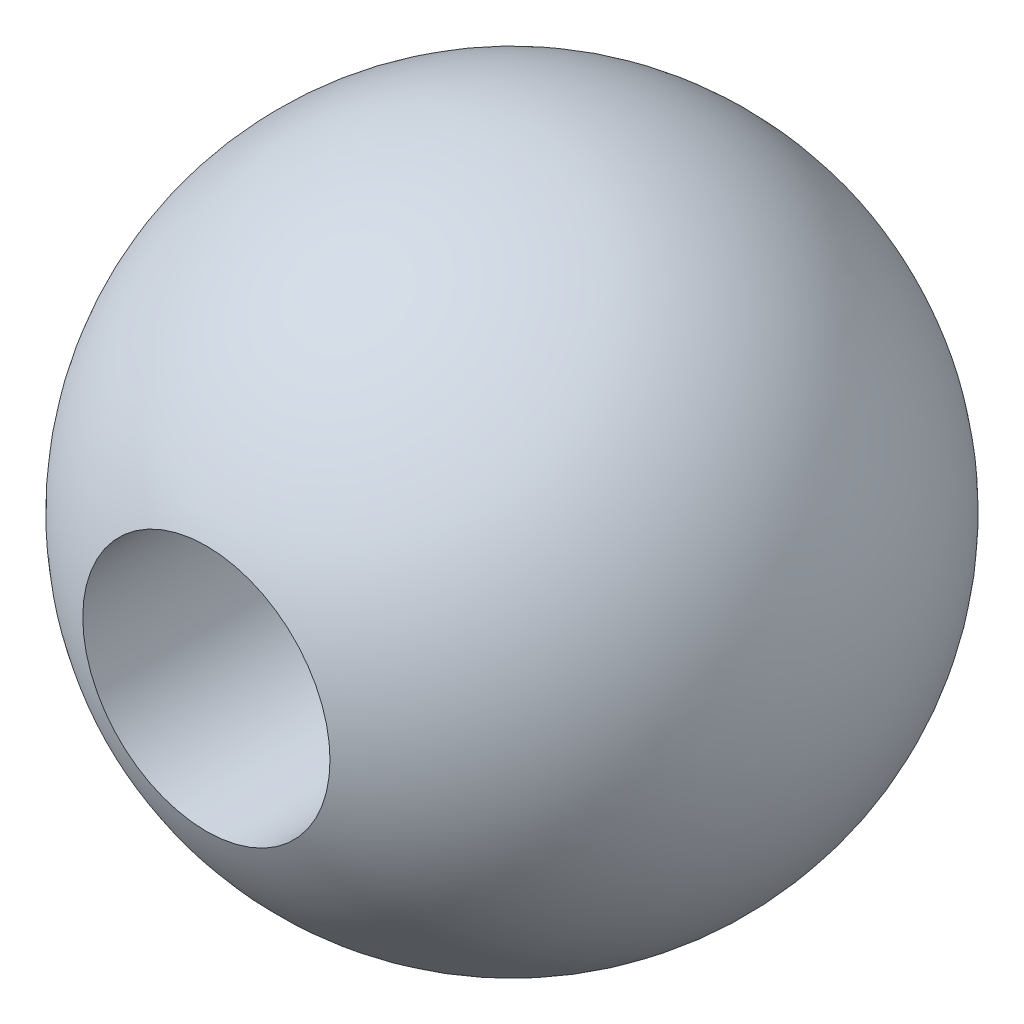
from build123d import *

# Parameters (mm, degrees)
SKETCH2_R          = 9.525
CUT_EXTRUDE1_DEPTH = 19.05


with BuildPart() as part:
    # Sketch1 → Revolve1 (revolve)
    with BuildSketch(Plane.XY):
        with BuildLine():
            Line((0, 25.4), (0, -25.4))
            ThreePointArc((0, -25.4), (25.4, 0), (0, 25.4))
        make_face()
    revolve(axis=Axis((0, 25.4, 0), (0, -1, 0)))

    # Sketch2 → Cut-Extrude1 (cut)
    with BuildSketch(Plane.XY.offset(25.4)):
        Circle(SKETCH2_R)
    extrude(amount=-CUT_EXTRUDE1_DEPTH, mode=Mode.SUBTRACT)


solid = part.part
